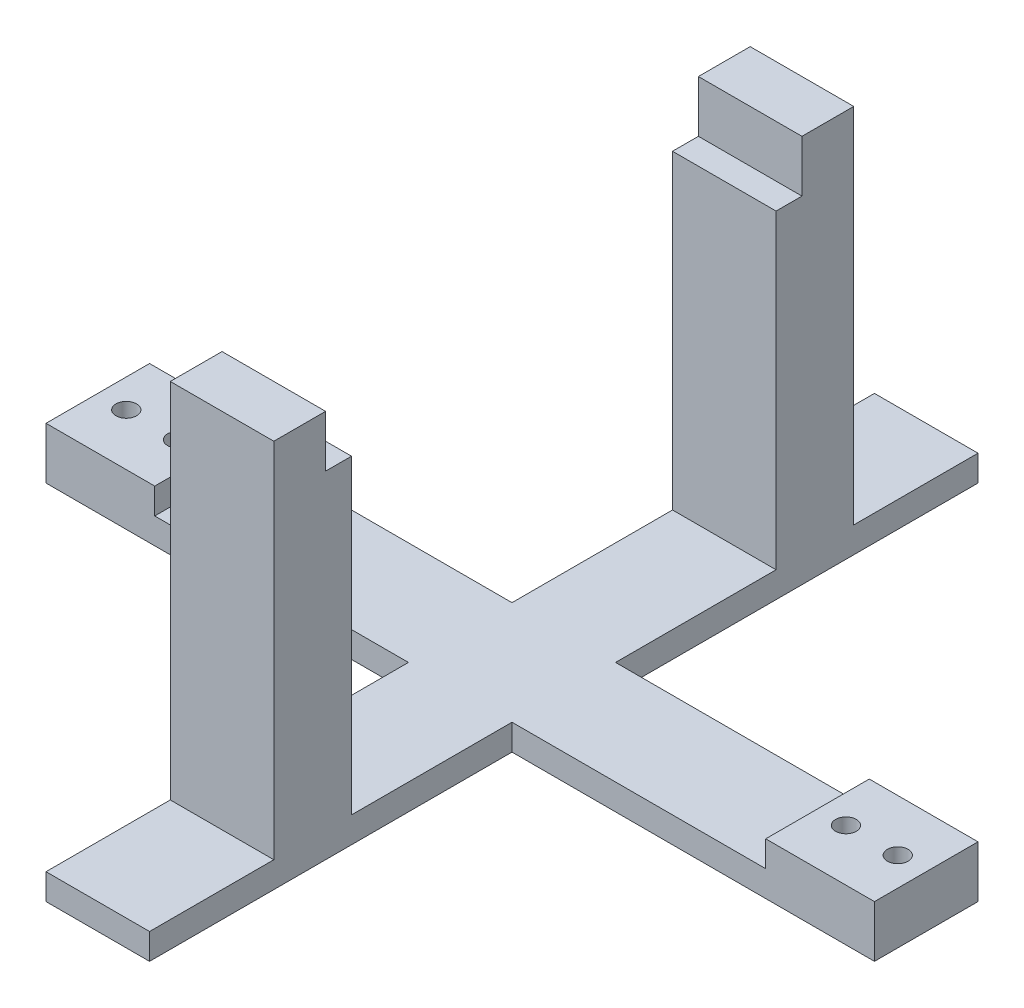
from build123d import *

# Parameters (mm, degrees)
BOSS_EXTRUDE1_DEPTH            = 5
SKETCH3_W                      = 21
SKETCH3_H                      = 20
BOSS_EXTRUDE2_DEPTH            = 5
F_4_0MM_DOWEL_HOLE1_AT_2_COUNT = 2
F_4_0MM_DOWEL_HOLE1_AT_2_PITCH = 10
SKETCH15_W                     = 20
SKETCH15_H                     = 15
BOSS_EXTRUDE6_DEPTH            = 60
SKETCH16_W                     = 20
SKETCH16_H                     = 10
BOSS_EXTRUDE7_DEPTH            = 10


with BuildPart() as part:
    # Sketch2 → Boss-Extrude1 (new body)
    with BuildSketch(Plane(origin=(0, 0, 0), x_dir=(1, 0, 0), z_dir=(0, 1, 0))):
        Polygon((-80, -10), (-10, -10), (-10, -80), (10, -80), (10, -10), (80, -10), (80, 10), (10, 10), (10, 80), (-10, 80), (-10, 10), (-80, 10), align=None)
    extrude(amount=BOSS_EXTRUDE1_DEPTH)

    # Sketch3 → Boss-Extrude2 (add)
    with BuildSketch(Plane(origin=(0, 5, 0), x_dir=(1, 0, 0), z_dir=(0, 1, 0))):
        with Locations((-69.5, 0)):
            Rectangle(SKETCH3_W, SKETCH3_H)
    boss_extrude2 = extrude(amount=BOSS_EXTRUDE2_DEPTH)

    # Sketch5 → Ø4.0mm Dowel Hole1 (revolve, cut)
    with BuildSketch(Plane(origin=(-64.5, 10, 0), x_dir=(0, 0, 1), z_dir=(1, 0, 0))):
        Polygon((0, 0), (0, 118.830821238), (2, 117.6291), (2, 0), align=None)
    f_4_0mm_dowel_hole1 = revolve(axis=Axis((-64.5, 16.35, 0), (0, -1, 0)), mode=Mode.SUBTRACT)

    # Ø4.0mm Dowel Hole1 at 2: Ø4.0mm Dowel Hole1 ×2
    with Locations(*[(-i * F_4_0MM_DOWEL_HOLE1_AT_2_PITCH, 0, 0) for i in range(1, F_4_0MM_DOWEL_HOLE1_AT_2_COUNT)]):
        add(f_4_0mm_dowel_hole1, mode=Mode.SUBTRACT)

    # Mirror1: Boss-Extrude2, Ø4.0mm Dowel Hole1 across plane
    add(boss_extrude2.mirror(Plane(origin=(0, 0, 0), x_dir=(0, 0, 1), z_dir=(1, 0, 0))))
    add(f_4_0mm_dowel_hole1.mirror(Plane(origin=(0, 0, 0), x_dir=(0, 0, 1), z_dir=(1, 0, 0))), mode=Mode.SUBTRACT)

    # Mirror1 copy 1 sketch → Mirror1 copy 1 (revolve, cut)
    with BuildSketch(Plane(origin=(74.5, 10, 0), x_dir=(0, 0, 1), z_dir=(-1, 0, 0))):
        Polygon((0, 0), (0, -118.830821238), (2, -117.6291), (2, 0), align=None)
    revolve(axis=Axis((74.5, 16.35, 0), (0, 1, 0)), mode=Mode.SUBTRACT)

    # Sketch15 → Boss-Extrude6 (add)
    with BuildSketch(Plane(origin=(0, 5, 0), x_dir=(1, 0, 0), z_dir=(0, 1, 0))):
        with Locations((0, 48.5)):
            Rectangle(SKETCH15_W, SKETCH15_H)
        with Locations((0, -48.5)):
            Rectangle(SKETCH15_W, SKETCH15_H)
    extrude(amount=BOSS_EXTRUDE6_DEPTH)

    # Sketch16 → Boss-Extrude7 (add)
    with BuildSketch(Plane(origin=(0, 65, 0), x_dir=(1, 0, 0), z_dir=(0, 1, 0))):
        with Locations((0, 51)):
            Rectangle(SKETCH16_W, SKETCH16_H)
        with Locations((0, -51)):
            Rectangle(SKETCH16_W, SKETCH16_H)
    extrude(amount=BOSS_EXTRUDE7_DEPTH)


solid = part.part
